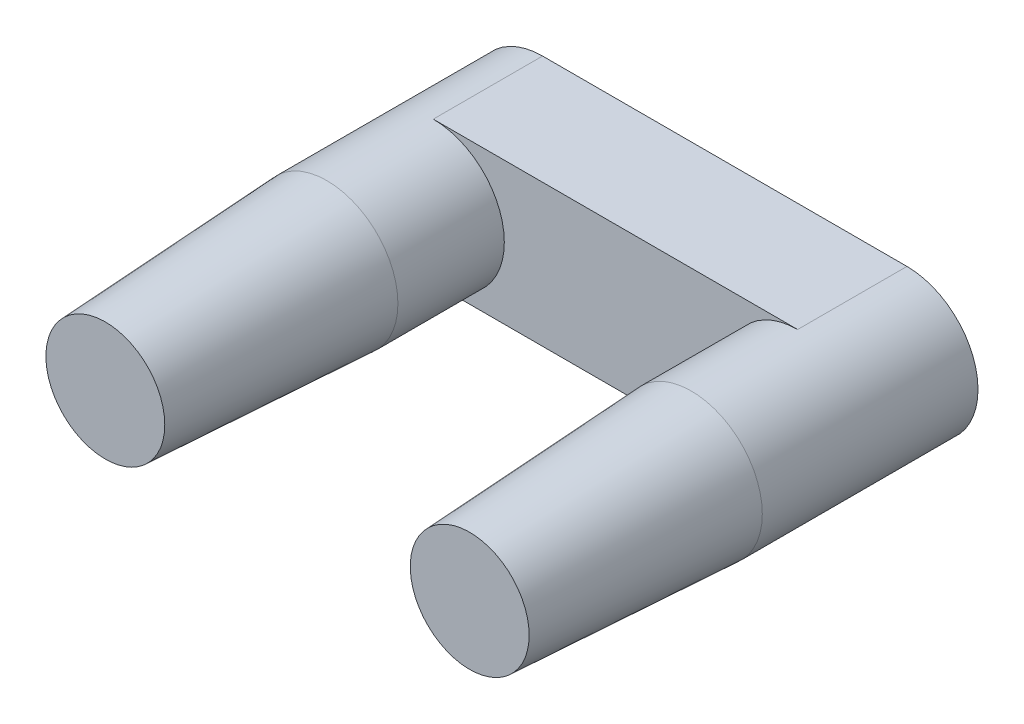
from build123d import *
from OCP.BRepFilletAPI import BRepFilletAPI_MakeChamfer

# Parameters (mm, degrees)
SKETCH1_R             = 1.95
BOSS_EXTRUDE1_DEPTH   = 9
BOSS_EXTRUDE1_2_DEPTH = 9
BOSS_EXTRUDE2_START   = -3
BOSS_EXTRUDE2_DEPTH   = 3
CHAMFER1_SIZE         = 6.08
CHAMFER1_SIZE2        = 0.318639298


with BuildPart() as part:
    # Sketch1 → Boss-Extrude1 (new body)
    with BuildSketch(Plane.XY):
        with Locations((-10, 0)):
            Circle(SKETCH1_R)
    extrude(amount=BOSS_EXTRUDE1_DEPTH)



with BuildPart() as body_2:
    # Sketch1 → Boss-Extrude1 2 (new body)
    with BuildSketch(Plane.XY):
        Circle(SKETCH1_R)
    extrude(amount=BOSS_EXTRUDE1_2_DEPTH)


with BuildPart() as part_1:
    add(part.part)

    add(body_2.part)  # Boss-Extrude2 merges body 2
    # Sketch1<3> → Boss-Extrude2 (add)
    with BuildSketch(Plane.XY.offset(BOSS_EXTRUDE2_START)):
        with BuildLine():
            Line((0, 1.95), (-10, 1.95))
            ThreePointArc((-10, 1.95), (-11.95, 0), (-10, -1.95))
            Line((-10, -1.95), (0, -1.95))
            ThreePointArc((0, -1.95), (1.95, 0), (0, 1.95))
        make_face()
    extrude(amount=BOSS_EXTRUDE2_DEPTH)

    # Chamfer1: one chamfer whose edges measure the first distance from different faces: ONE call of the kernel's chamfer builder (chamfer() names one face for all edges)
    chamfer1_edges_1 = [part_1.edges().sort_by_distance(p)[0] for p in [
        (-1.95, 0, 9),
    ]]
    chamfer1_side_1 = [part_1.faces().sort_by_distance(p)[0] for p in [
        (-1.378858223, 1.378858223, 3),
    ]]
    chamfer1_edges_2 = [part_1.edges().sort_by_distance(p)[0] for p in [
        (-11.95, 0, 9),
    ]]
    chamfer1_side_2 = [part_1.faces().sort_by_distance(p)[0] for p in [
        (-11.95, 0, 3),
    ]]
    chamfer1 = BRepFilletAPI_MakeChamfer(part_1.part.solid().wrapped)
    for e in chamfer1_edges_1:
        chamfer1.Add(CHAMFER1_SIZE, CHAMFER1_SIZE2, e.wrapped, chamfer1_side_1[0].wrapped)  # the first distance lies on this face
    for e in chamfer1_edges_2:
        chamfer1.Add(CHAMFER1_SIZE, CHAMFER1_SIZE2, e.wrapped, chamfer1_side_2[0].wrapped)  # the first distance lies on this face
    add(Compound.cast(chamfer1.Shape()), mode=Mode.REPLACE)


solid = part_1.part
